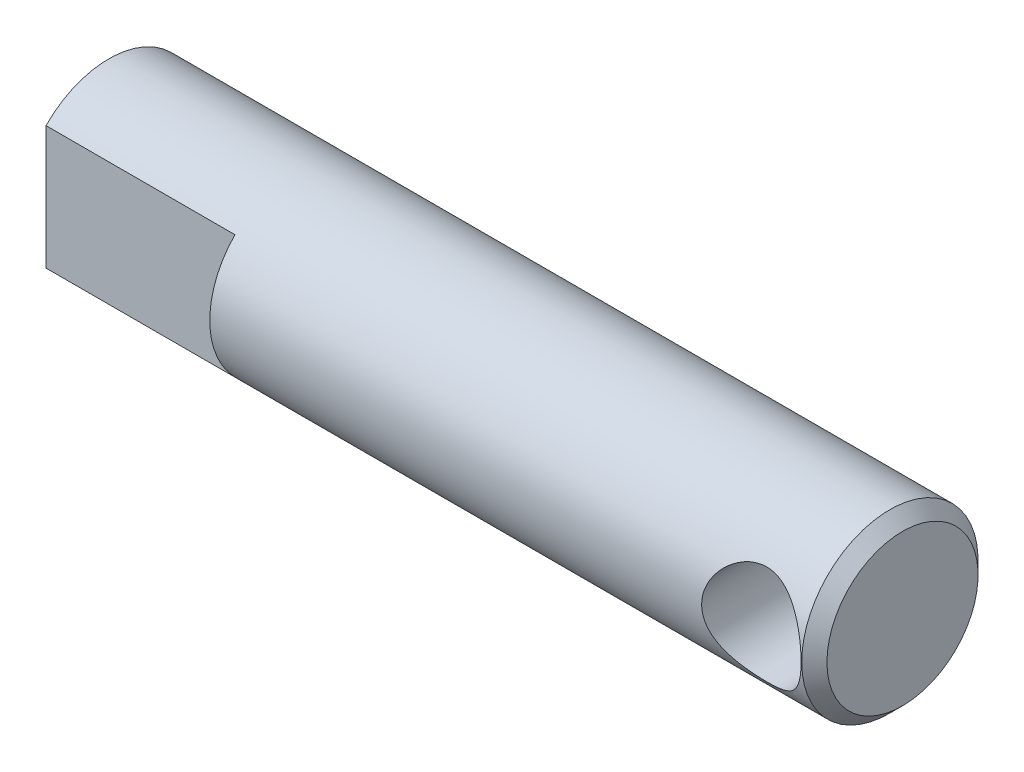
from build123d import *

# Parameters (mm, degrees)
ESQUISSE1_W                  = 63
ESQUISSE1_H                  = 7
CHANFREIN1_SIZE              = 1
ENL_V_MAT_EXTRU_2_DEPTH      = 10
ENL_V_MAT_EXTRU_2_DEPTH_BACK = 10
ESQUISSE2_R                  = 3.95
ESQUISSE3_W                  = 3
ESQUISSE3_H                  = 13
ENL_V_MAT_EXTRU_3_DEPTH      = 15


with BuildPart() as part:
    # Esquisse1 → Base-Révolution (revolve)
    with BuildSketch(Plane.XY, mode=Mode.PRIVATE) as base_r_volution_sk:
        with Locations((-26.5, 3.5)):
            Rectangle(ESQUISSE1_W, ESQUISSE1_H)
    revolve(base_r_volution_sk.sketch.rotate(Axis((9, 0, 0), (-1, 0, 0)), 314.415308597), axis=Axis((9, 0, 0), (-1, 0, 0)))

    # Chanfrein1
    chanfrein1_edges = [part.edges().sort_by_distance(p)[0] for p in [
        (5, -4.898979486, -5),
    ]]
    chamfer(chanfrein1_edges, length=CHANFREIN1_SIZE)

    # Esquisse2 → Enlèv. mat.-Extru.2 (cut, two sides: drawn at the far end of the back side and taken through both)
    with BuildSketch(Plane.XY.offset(-ENL_V_MAT_EXTRU_2_DEPTH_BACK)):
        Circle(ESQUISSE2_R)
    extrude(amount=ENL_V_MAT_EXTRU_2_DEPTH + ENL_V_MAT_EXTRU_2_DEPTH_BACK, mode=Mode.SUBTRACT)

    # Esquisse3 → Enlèv. mat.-Extru.3 (cut)
    with BuildSketch(Plane.ZY.offset(58)):
        with Locations((6.5, 0.5)):
            Rectangle(ESQUISSE3_W, ESQUISSE3_H)
    extrude(amount=-ENL_V_MAT_EXTRU_3_DEPTH, mode=Mode.SUBTRACT)


solid = part.part
